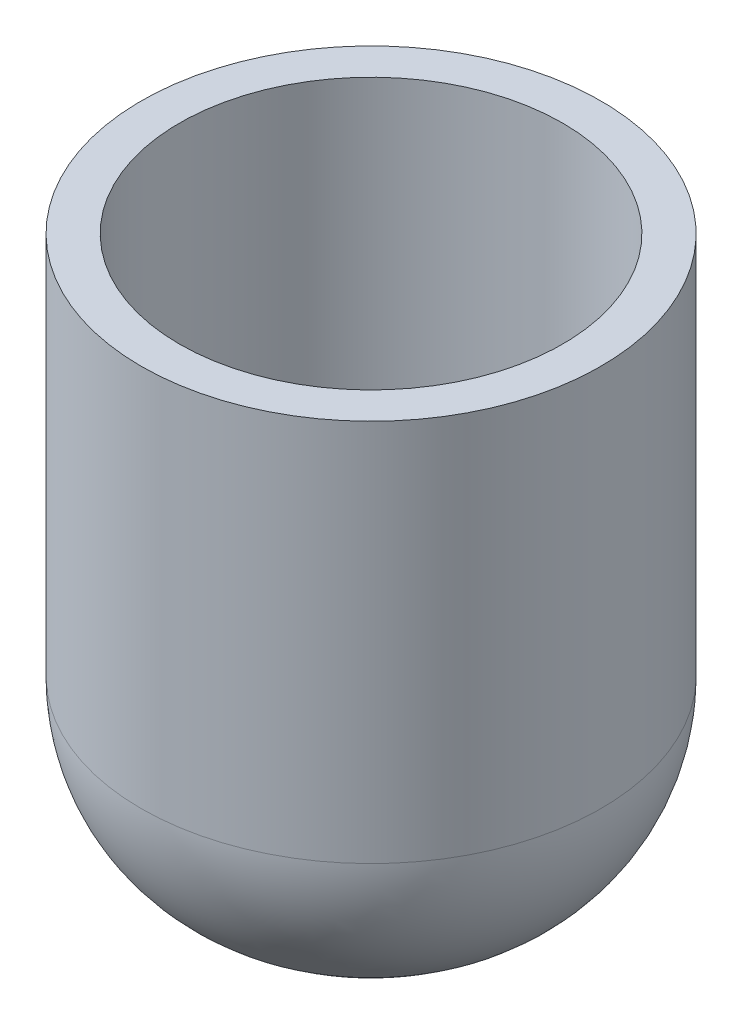
from build123d import *

# Parameters (mm, degrees)
SKETCH1_R           = 7.62
BOSS_EXTRUDE1_DEPTH = 19.05
FILLET1_R           = 6.35
SHELL1_T            = -1.27


with BuildPart() as part:
    # Sketch1 → Boss-Extrude1 (new body)
    with BuildSketch(Plane(origin=(0, 0, 0), x_dir=(1, 0, 0), z_dir=(0, 1, 0))):
        with Locations(Location((0, 0, 0), (0, 0, 270))):
            Circle(SKETCH1_R)
    extrude(amount=-BOSS_EXTRUDE1_DEPTH)

    # Fillet1
    fillet1_edges = [part.edges().sort_by_distance(p)[0] for p in [
        (0, -19.05, -7.62),
    ]]
    fillet(fillet1_edges, radius=FILLET1_R)

    # Shell1
    shell1_openings = [part.faces().sort_by_distance(p)[0] for p in [
        (0, 0, 0),
    ]]
    offset(amount=SHELL1_T, openings=shell1_openings, kind=Kind.INTERSECTION)


solid = part.part
